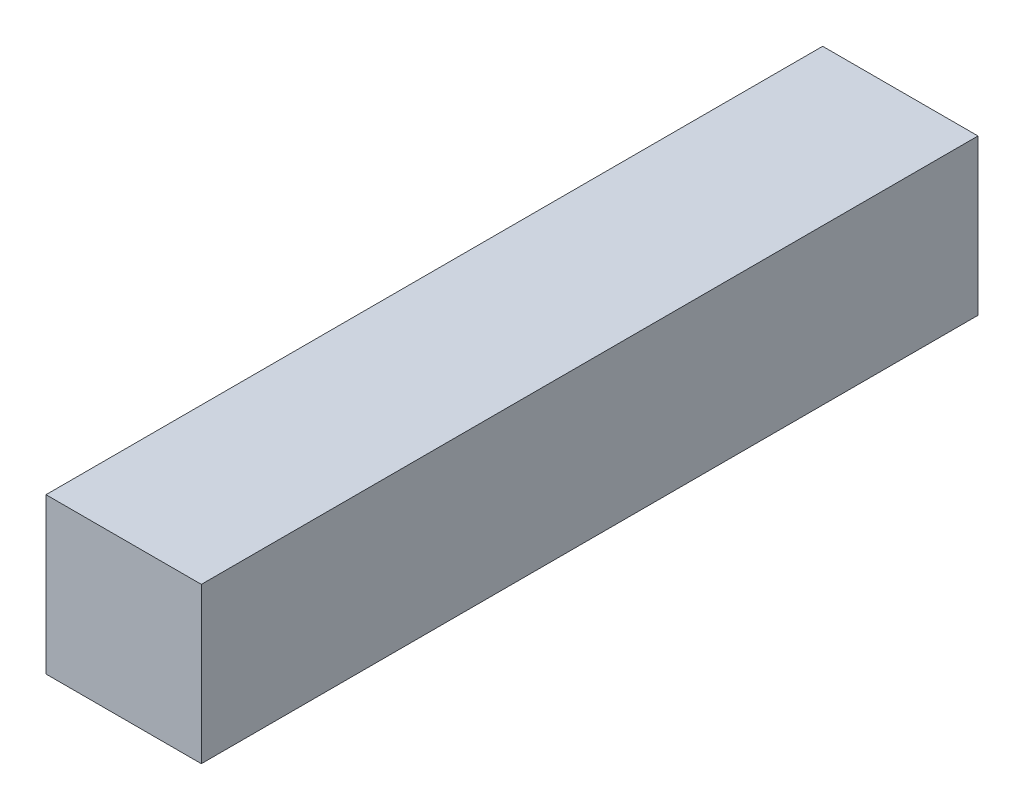
from build123d import *

# Parameters (mm, degrees)
SKETCH2_W           = 4
SKETCH2_H           = 20
BOSS_EXTRUDE1_DEPTH = 4


with BuildPart() as part:
    # Sketch2 → Boss-Extrude1 (new body)
    with BuildSketch(Plane(origin=(0, 0, 0), x_dir=(1, 0, 0), z_dir=(0, 1, 0))):
        Rectangle(SKETCH2_W, SKETCH2_H)
    extrude(amount=BOSS_EXTRUDE1_DEPTH)


solid = part.part
